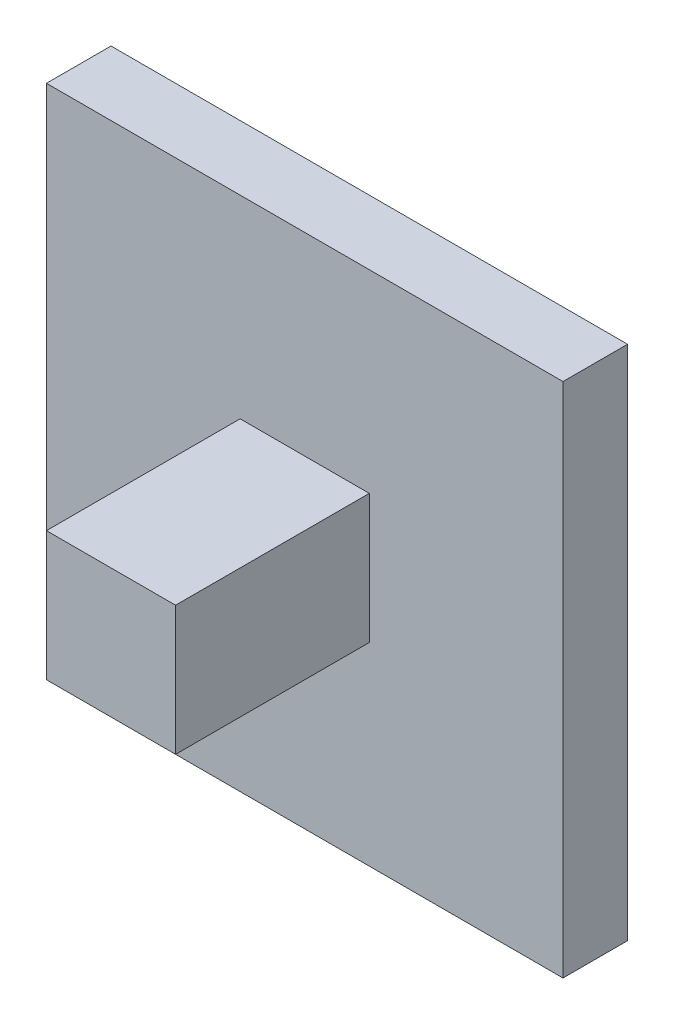
from build123d import *

# Parameters (mm, degrees)
ESQUISSE1_W        = 16
ESQUISSE1_H        = 16
BOSS_EXTRU_1_DEPTH = 2
ESQUISSE2_W        = 4
ESQUISSE2_H        = 4
BOSS_EXTRU_2_DEPTH = 6


with BuildPart() as part:
    # Esquisse1 → Boss.-Extru.1 (new body)
    with BuildSketch(Plane.XY):
        with Locations((8, 8)):
            Rectangle(ESQUISSE1_W, ESQUISSE1_H)
    extrude(amount=BOSS_EXTRU_1_DEPTH)

    # Esquisse2 → Boss.-Extru.2 (add)
    with BuildSketch(Plane.XY.offset(2)):
        with Locations((8, 8)):
            Rectangle(ESQUISSE2_W, ESQUISSE2_H)
    extrude(amount=BOSS_EXTRU_2_DEPTH)


solid = part.part
